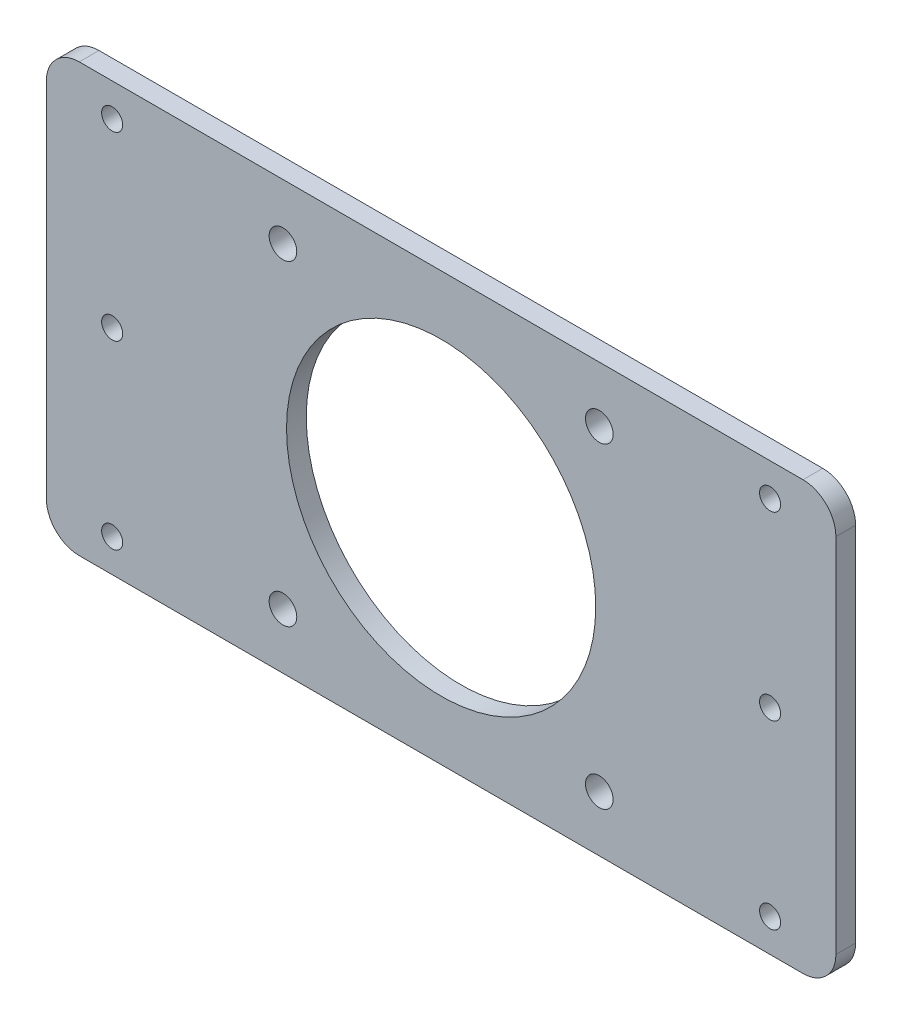
from build123d import *

# Parameters (mm, degrees)
SKETCH_1_W          = 120
SKETCH_1_H          = 65
EXTRUDE_1_DEPTH     = 3
SKETCH_2_R          = 1.6
CUT_EXTRUDE_1_DEPTH = 137.506410106
FILLET_1_R          = 5
SKETCH_3_R          = 23.5
CUT_EXTRUDE_2_DEPTH = 10
SKETCH_4_R          = 2.1
CUT_EXTRUDE_3_DEPTH = 5


with BuildPart() as part:
    # 草图1 → 凸台-拉伸1 (new body)
    with BuildSketch(Plane.XY):
        with Locations((60, -32.5)):
            Rectangle(SKETCH_1_W, SKETCH_1_H)
    extrude(amount=EXTRUDE_1_DEPTH)

    # 草图2 → 切除-拉伸1 (cut, through all)
    with BuildSketch(Plane.XY.offset(3)):
        with Locations((10, -5)):
            Circle(SKETCH_2_R)
        with Locations((10, -32.5)):
            Circle(SKETCH_2_R)
        with Locations((10, -60)):
            Circle(SKETCH_2_R)
        with Locations(Location((110, -60, 0), (0, 0, 180))):
            Circle(SKETCH_2_R)
        with Locations(Location((110, -32.5, 0), (0, 0, 180))):
            Circle(SKETCH_2_R)
        with Locations(Location((110, -5, 0), (0, 0, 180))):
            Circle(SKETCH_2_R)
    extrude(amount=-CUT_EXTRUDE_1_DEPTH, mode=Mode.SUBTRACT)

    # 圆角1
    fillet_1_edges = [part.edges().sort_by_distance(p)[0] for p in [
        (0, 0, 1.5),
        (120, 0, 1.5),
        (120, -65, 1.5),
        (0, -65, 1.5),
    ]]
    fillet(fillet_1_edges, radius=FILLET_1_R)

    # 草图3 → 切除-拉伸2 (cut)
    with BuildSketch(Plane.XY.offset(3)):
        with Locations((60, -32.5)):
            Circle(SKETCH_3_R)
    extrude(amount=-CUT_EXTRUDE_2_DEPTH, mode=Mode.SUBTRACT)

    # 草图4 → 切除-拉伸3 (cut, symmetric)
    with BuildSketch(Plane.XY.offset(3)):
        with Locations((84.04163056, -8.45836944)):
            Circle(SKETCH_4_R)
        with Locations((84.04163056, -56.54163056)):
            Circle(SKETCH_4_R)
        with Locations((35.95836944, -56.54163056)):
            Circle(SKETCH_4_R)
        with Locations((35.95836944, -8.45836944)):
            Circle(SKETCH_4_R)
    extrude(amount=CUT_EXTRUDE_3_DEPTH, both=True, mode=Mode.SUBTRACT)


solid = part.part
